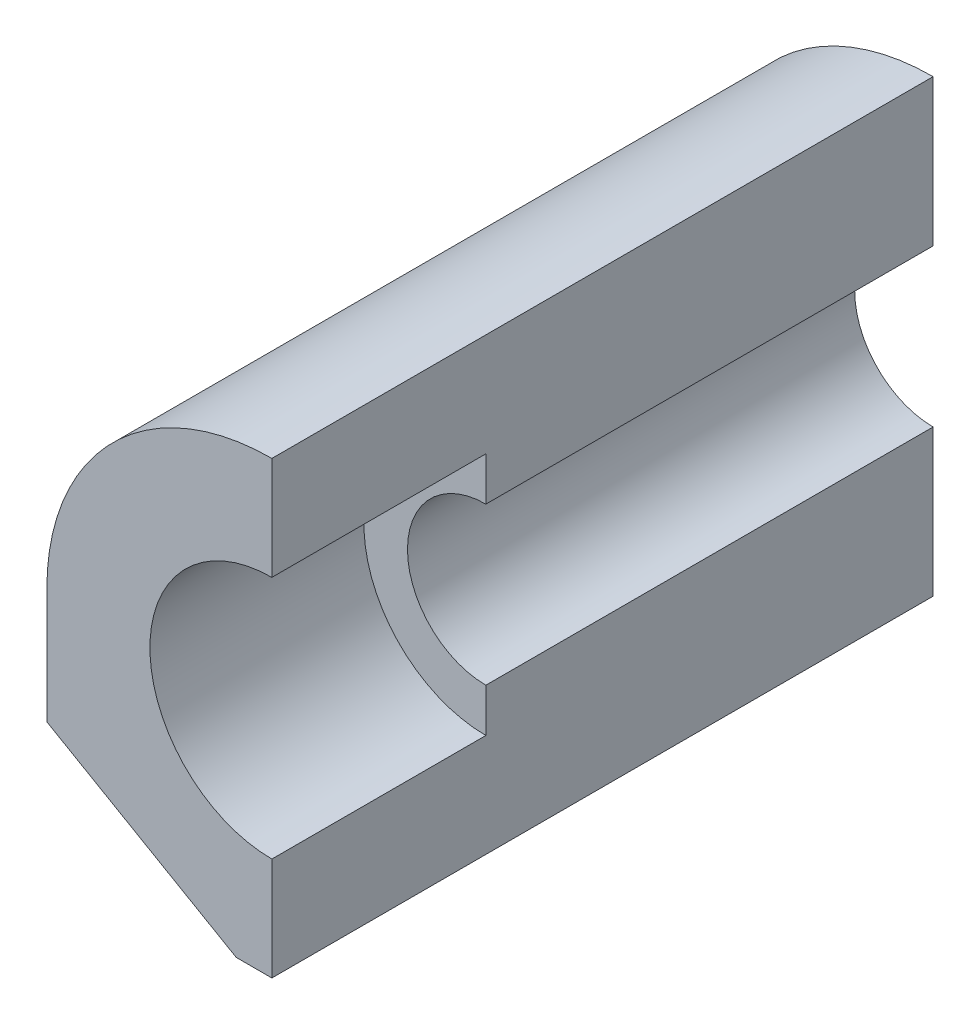
from build123d import *

# Parameters (mm, degrees)
BOSS_EXTRUDE1_DEPTH = 241
CUT_EXTRUDE1_DEPTH  = 78


with BuildPart() as part:
    # Sketch2 → Boss-Extrude1 (new body)
    with BuildSketch(Plane.XY):
        with BuildLine():
            Line((0, -28.575), (0, -82))
            Line((0, -82), (-13, -82))
            Line((-13, -82), (-82, -42.162831426))
            Line((-82, -42.162831426), (-82, 0))
            ThreePointArc((-82, 0), (-57.982756057, 57.982756057), (0, 82))
            Line((0, 82), (0, 28.575))
            ThreePointArc((0, 28.575), (-28.575, 0), (0, -28.575))
        make_face()
    extrude(amount=-BOSS_EXTRUDE1_DEPTH)

    # Sketch3 → Cut-Extrude1 (cut)
    with BuildSketch(Plane.XY):
        with BuildLine():
            Line((0, 44.45), (0, 28.575))
            ThreePointArc((0, 28.575), (-28.575, 0), (0, -28.575))
            Line((0, -28.575), (0, -44.45))
            ThreePointArc((0, -44.45), (-44.45, 0), (0, 44.45))
        make_face()
    extrude(amount=-CUT_EXTRUDE1_DEPTH, mode=Mode.SUBTRACT)


solid = part.part
